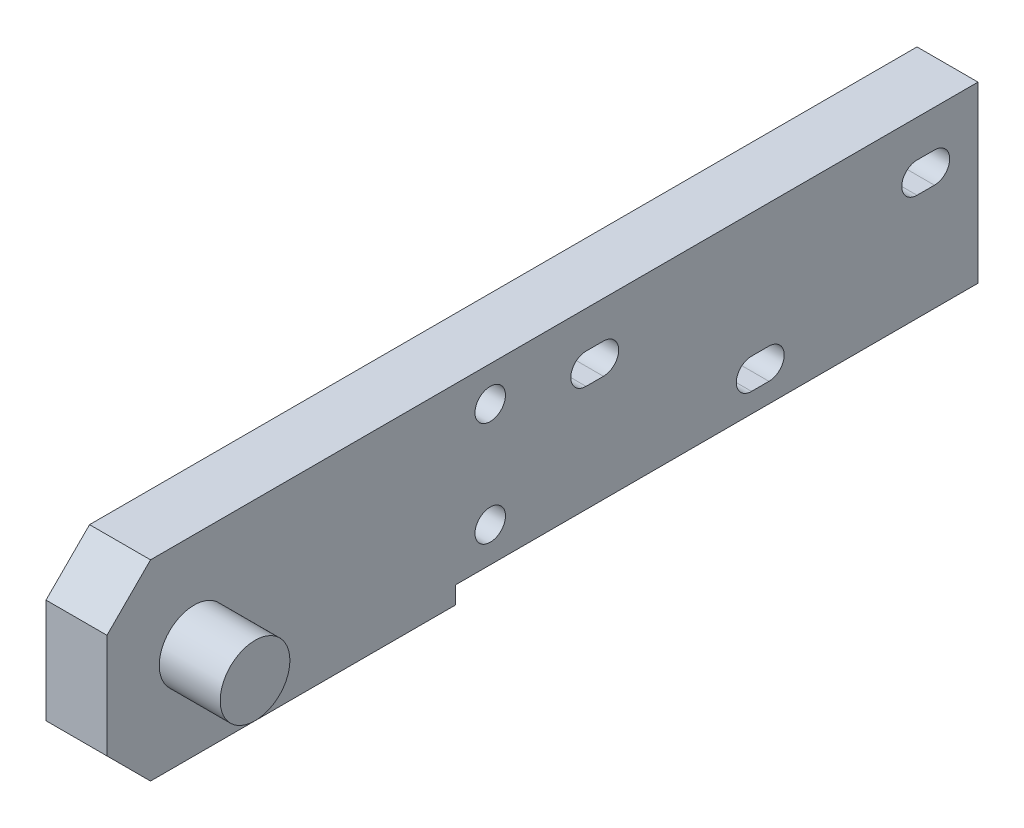
from build123d import *

# Parameters (mm, degrees)
SKETCH1_R           = 1.75
BOSS_EXTRUDE1_DEPTH = 7
BOSS_EXTRUDE2_START = 7
SKETCH1_4_R         = 4
BOSS_EXTRUDE2_DEPTH = 7


with BuildPart() as part:
    # Sketch1 → Boss-Extrude1 (new body)
    with BuildSketch(Plane(origin=(0, 0, 0), x_dir=(0, 0, -1), z_dir=(1, 0, 0))):
        Polygon((-5, 11), (-10, 6), (-10, -6), (-5, -11), (30, -11), (30, -9), (90, -9), (90, 11), align=None)
        with Locations((34, 7)):
            Circle(SKETCH1_R, mode=Mode.SUBTRACT)
        with Locations((34, -5)):
            Circle(SKETCH1_R, mode=Mode.SUBTRACT)
        with BuildLine():
            Line((45, 6.75), (47, 6.75))
            ThreePointArc((47, 6.75), (48.75, 5), (47, 3.25))
            Line((47, 3.25), (45, 3.25))
            ThreePointArc((45, 3.25), (43.25, 5), (45, 6.75))
        make_face(mode=Mode.SUBTRACT)
        with BuildLine():
            Line((64, -3.25), (66, -3.25))
            ThreePointArc((66, -3.25), (67.75, -5), (66, -6.75))
            Line((66, -6.75), (64, -6.75))
            ThreePointArc((64, -6.75), (62.25, -5), (64, -3.25))
        make_face(mode=Mode.SUBTRACT)
        with BuildLine():
            Line((85, 3.25), (83, 3.25))
            ThreePointArc((83, 3.25), (81.25, 5), (83, 6.75))
            Line((83, 6.75), (85, 6.75))
            ThreePointArc((85, 6.75), (86.75, 5), (85, 3.25))
        make_face(mode=Mode.SUBTRACT)
    extrude(amount=BOSS_EXTRUDE1_DEPTH)

    # Sketch1<4> → Boss-Extrude2 (add)
    with BuildSketch(Plane(origin=(0, 0, 0), x_dir=(0, 0, -1), z_dir=(1, 0, 0)).offset(BOSS_EXTRUDE2_START)):
        Circle(SKETCH1_4_R)
    extrude(amount=BOSS_EXTRUDE2_DEPTH)


solid = part.part
